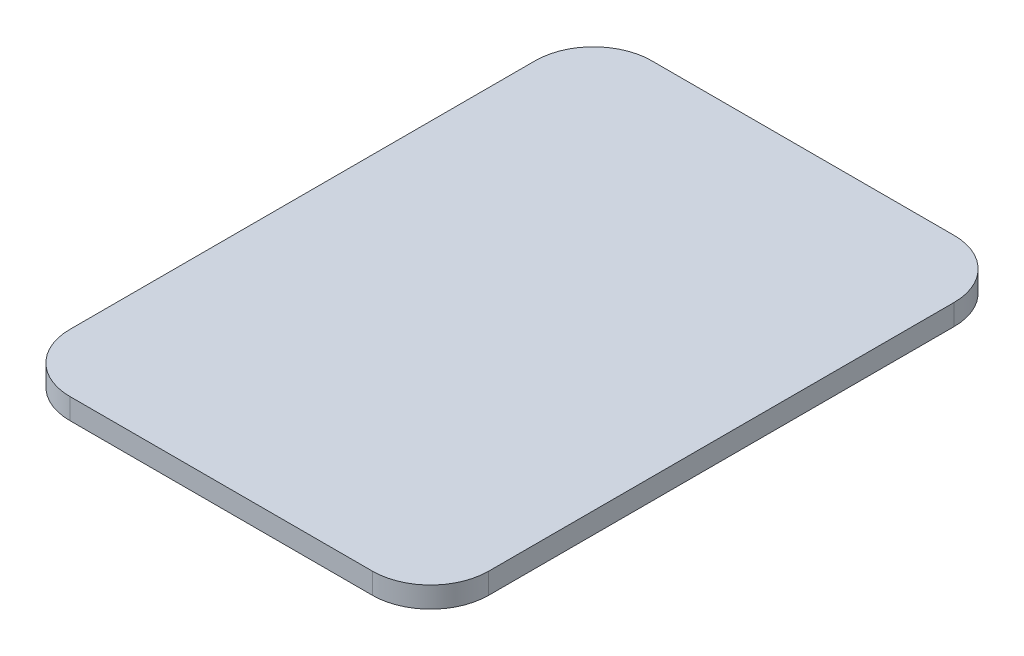
from build123d import *

# Parameters (mm, degrees)
BOSS_EXTRUDE1_DEPTH = 9


with BuildPart() as part:
    # Sketch1 → Boss-Extrude1 (new body)
    with BuildSketch(Plane(origin=(0, 0, 0), x_dir=(1, 0, 0), z_dir=(0, 1, 0))):
        with BuildLine():
            Line((-65, -125), (65, -125))
            ThreePointArc((65, -125), (82.67766953, -117.67766953), (90, -100))
            Line((90, -100), (90, 100))
            ThreePointArc((90, 100), (82.67766953, 117.67766953), (65, 125))
            Line((65, 125), (-65, 125))
            ThreePointArc((-65, 125), (-82.67766953, 117.67766953), (-90, 100))
            Line((-90, 100), (-90, -100))
            ThreePointArc((-90, -100), (-82.67766953, -117.67766953), (-65, -125))
        make_face()
    extrude(amount=BOSS_EXTRUDE1_DEPTH)


solid = part.part
